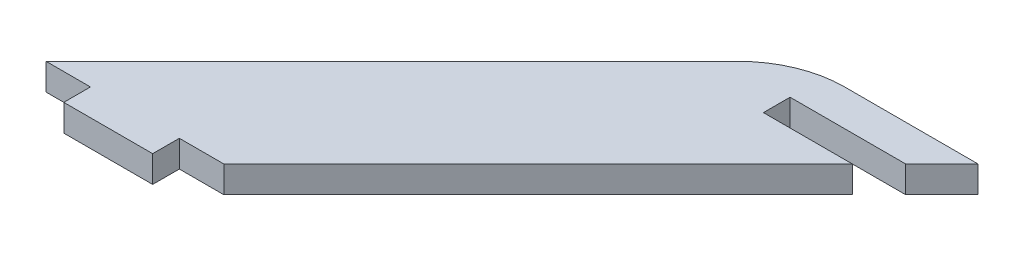
from build123d import *

# Parameters (mm, degrees)
RESSALTO_EXTRUS_O1_DEPTH = 3


with BuildPart() as part:
    # Esboço1 → Ressalto-extrusão1 (new body)
    with BuildSketch(Plane(origin=(0, 0, 0), x_dir=(1, 0, 0), z_dir=(0, 1, 0))):
        with BuildLine():
            Line((-12.989253032, -17.540319489), (-2.989253032, -17.540319489))
            Line((-2.989253032, -17.540319489), (-2.989253032, -14.540319489))
            Line((-2.989253032, -14.540319489), (2.010746968, -14.540319489))
            Line((2.010746968, -14.540319489), (37.366086027, 20.81501957))
            Line((37.366086027, 20.81501957), (27.366086027, 20.81501957))
            Line((27.366086027, 20.81501957), (27.366086027, 23.81501957))
            Line((27.366086027, 23.81501957), (40.366086027, 23.81501957))
            Line((40.366086027, 23.81501957), (44.437153839, 27.886087382))
            Line((44.437153839, 27.886087382), (29.437153839, 27.886087382))
            ThreePointArc((29.437153839, 27.886087382), (24.817756177, 26.967232057), (20.901619933, 24.350553476))
            Line((20.901619933, 24.350553476), (-17.989253032, -14.540319489))
            Line((-17.989253032, -14.540319489), (-12.989253032, -14.540319489))
            Line((-12.989253032, -14.540319489), (-12.989253032, -17.540319489))
        make_face()
    extrude(amount=RESSALTO_EXTRUS_O1_DEPTH)


solid = part.part
